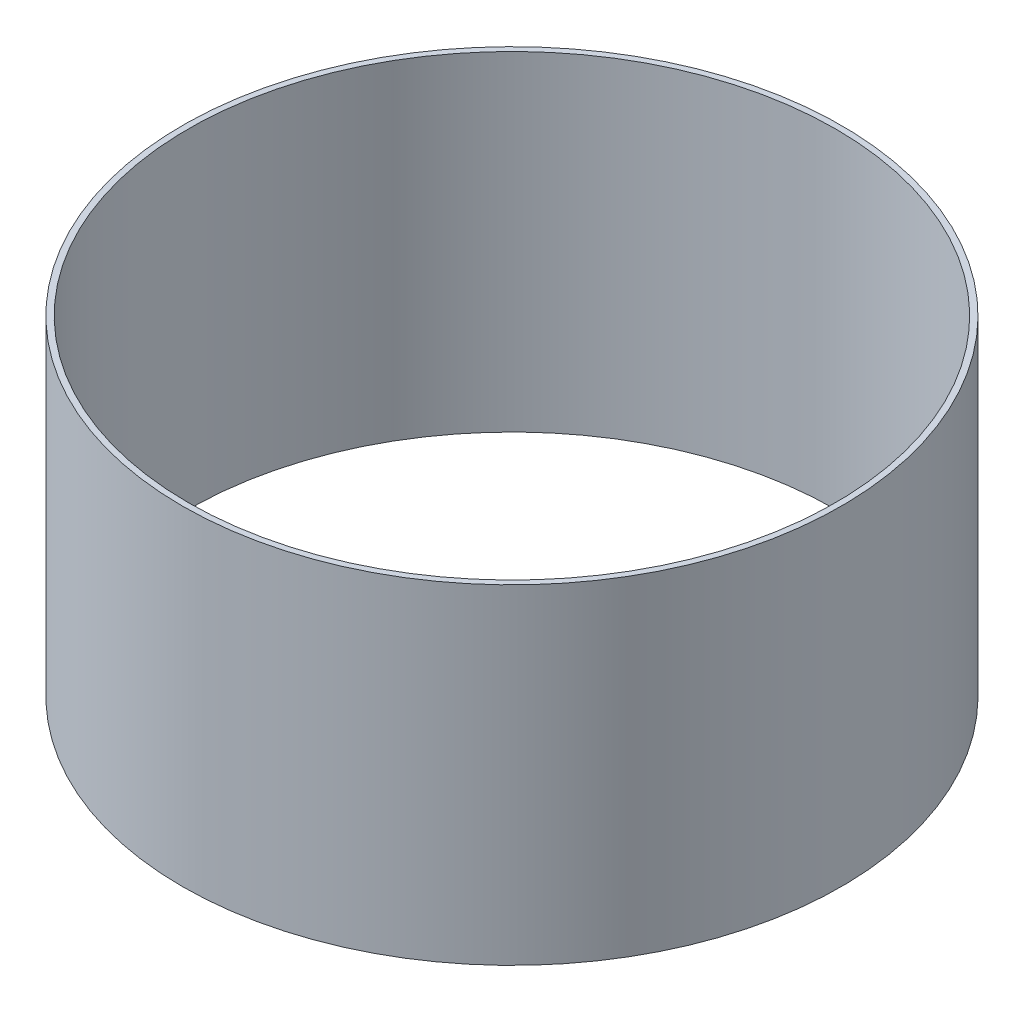
from build123d import *

# Parameters (mm, degrees)
SKETCH_1_R      = 14
SKETCH_1_R_2    = 13.75
EXTRUDE_1_DEPTH = 14


with BuildPart() as part:
    # ｽｹｯﾁ1 → ﾎﾞｽ - 押し出し1 (new body)
    with BuildSketch(Plane(origin=(0, 0, 0), x_dir=(1, 0, 0), z_dir=(0, 1, 0))):
        with Locations(Location((0, 0, 0), (0, 0, 270))):
            Circle(SKETCH_1_R)
        with Locations(Location((0, 0, 0), (0, 0, 270))):
            Circle(SKETCH_1_R_2, mode=Mode.SUBTRACT)
    extrude(amount=EXTRUDE_1_DEPTH)


solid = part.part
